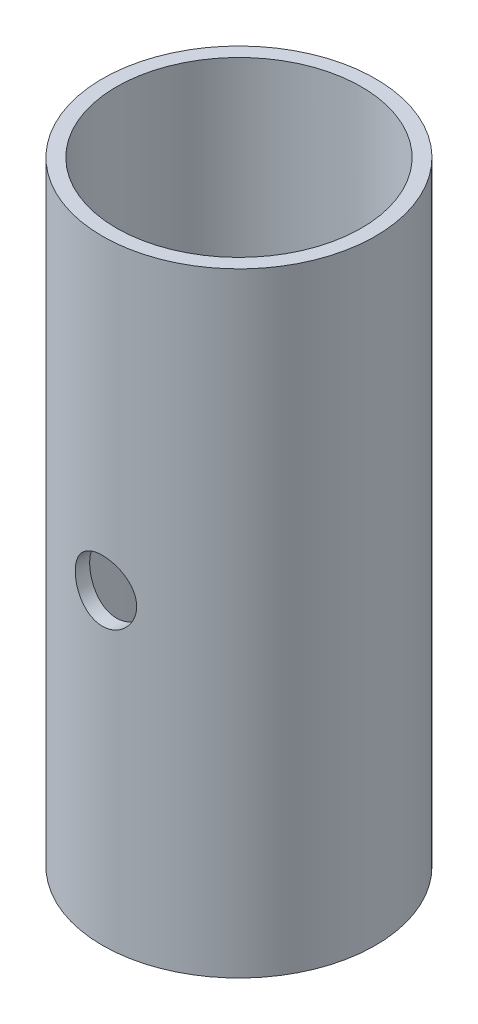
from build123d import *

# Parameters (mm, degrees)
SKETCH1_R               = 11.1125
SKETCH1_R_2             = 9.9695
BOSS_EXTRUDE1_DEPTH     = 25
CUT_EXTRUDE1_DEPTH      = 30.529228105
CUT_EXTRUDE1_DEPTH_BACK = 30.529228105
SKETCH2_R               = 2.5


with BuildPart() as part:
    # Sketch1 → Boss-Extrude1 (new, symmetric)
    with BuildSketch(Plane(origin=(0, 0, 0), x_dir=(1, 0, 0), z_dir=(0, 1, 0))):
        with Locations(Location((0, 0, 0), (0, 0, 270))):
            Circle(SKETCH1_R)
        with Locations(Location((0, 0, 0), (0, 0, 270))):
            Circle(SKETCH1_R_2, mode=Mode.SUBTRACT)
    extrude(amount=BOSS_EXTRUDE1_DEPTH, both=True)

    # Sketch2 → Cut-Extrude1 (cut, two sides: drawn at the far end of the back side and taken through both)
    with BuildSketch(Plane.XY.offset(-CUT_EXTRUDE1_DEPTH_BACK)):
        Circle(SKETCH2_R)
    extrude(amount=CUT_EXTRUDE1_DEPTH + CUT_EXTRUDE1_DEPTH_BACK, mode=Mode.SUBTRACT)


solid = part.part
